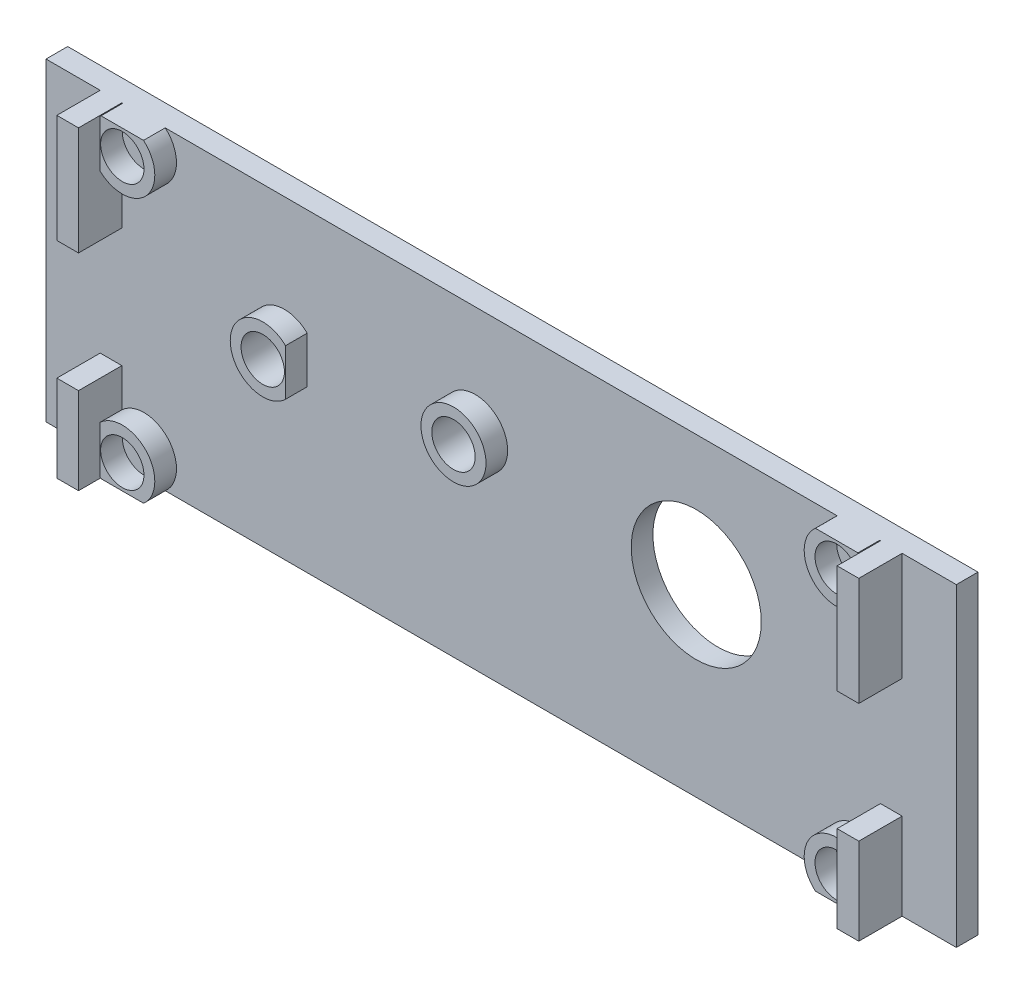
from build123d import *

# Parameters (mm, degrees)
SCHIZZO2_W                   = 42
SCHIZZO2_H                   = 14.5
SCHIZZO2_R                   = 3
SCHIZZO2_R_2                 = 1
ESTRUSIONE_ESTRUSIONE1_DEPTH = 1
SCHIZZO4_W                   = 1
SCHIZZO4_H                   = 5
SCHIZZO4_H_2                 = 4
ESTRUSIONE_ESTRUSIONE2_DEPTH = 2
SCHIZZO5_R                   = 1.5
SCHIZZO5_R_2                 = 1
ESTRUSIONE_ESTRUSIONE3_DEPTH = 1
TAGLIO_ESTRUSIONE1_START     = -1
TAGLIO_ESTRUSIONE1_DEPTH     = 1
ESTRUSIONE_ESTRUSIONE4_START = 1
SCHIZZO7_R                   = 1.5
ESTRUSIONE_ESTRUSIONE4_DEPTH = 1


with BuildPart() as part:
    # Schizzo2 → Estrusione-Estrusione1 (new body)
    with BuildSketch(Plane.XY):
        Rectangle(SCHIZZO2_W, SCHIZZO2_H)
        with Locations((9, 1.25)):
            Circle(SCHIZZO2_R, mode=Mode.SUBTRACT)
        with Locations((-1.2, 2.25)):
            Circle(SCHIZZO2_R_2, mode=Mode.SUBTRACT)
        with Locations((-10, 1.25)):
            Circle(SCHIZZO2_R_2, mode=Mode.SUBTRACT)
    extrude(amount=ESTRUSIONE_ESTRUSIONE1_DEPTH)

    # Schizzo4 → Estrusione-Estrusione2 (add)
    with BuildSketch(Plane.XY.offset(1)):
        with Locations((18, 4.75)):
            Rectangle(SCHIZZO4_W, SCHIZZO4_H)
        with Locations((18, -5.25)):
            Rectangle(SCHIZZO4_W, SCHIZZO4_H_2)
        with Locations((-18, -5.25)):
            Rectangle(SCHIZZO4_W, SCHIZZO4_H_2)
        with Locations((-18, 4.75)):
            Rectangle(SCHIZZO4_W, SCHIZZO4_H)
    extrude(amount=ESTRUSIONE_ESTRUSIONE2_DEPTH)

    # Schizzo5 → Estrusione-Estrusione3 (add)
    # profile 1 of 6: a face of its own
    with BuildSketch(Plane.XY.offset(1)):
        with Locations(Location((-1.2, 2.25, 0), (0, 0, 180))):
            Circle(SCHIZZO5_R)
        with Locations((-1.2, 2.25)):
            Circle(SCHIZZO5_R_2, mode=Mode.SUBTRACT)
    # profile 2 of 6: a face of its own
    with BuildSketch(Plane.XY.offset(1)):
        with Locations(Location((-10, 1.25, 0), (0, 0, 180))):
            Circle(SCHIZZO5_R)
        with Locations((-10, 1.25)):
            Circle(SCHIZZO5_R_2, mode=Mode.SUBTRACT)
    # profile 3 of 6: a face of its own
    with BuildSketch(Plane.XY.offset(1)):
        with BuildLine():
            Line((-17.5, 7.214212601), (-17.5, 5.014576268))
            ThreePointArc((-17.5, 5.014576268), (-15.362109211, 5.114234355), (-15.5, 7.25))
            Line((-15.5, 7.25), (-17.46, 7.25))
            ThreePointArc((-17.46, 7.25), (-17.480160079, 7.232285223), (-17.5, 7.214212601))
        make_face()
        with Locations((-16.48, 6.114394435)):
            Circle(SCHIZZO5_R_2, mode=Mode.SUBTRACT)
    # profile 4 of 6: a face of its own
    with BuildSketch(Plane.XY.offset(1)):
        with BuildLine():
            Line((-17.46, -7.25), (-15.5, -7.25))
            ThreePointArc((-15.5, -7.25), (-15.362109211, -5.114234355), (-17.5, -5.014576268))
            Line((-17.5, -5.014576268), (-17.5, -7.214212601))
            ThreePointArc((-17.5, -7.214212601), (-17.480160079, -7.232285223), (-17.46, -7.25))
        make_face()
        with Locations(Location((-16.48, -6.114394435, 0), (0, 0, 180))):
            Circle(SCHIZZO5_R_2, mode=Mode.SUBTRACT)
    # profile 5 of 6: a face of its own
    with BuildSketch(Plane.XY.offset(1)):
        with BuildLine():
            Line((17.46, -7.25), (15.5, -7.25))
            ThreePointArc((15.5, -7.25), (15.362109211, -5.114234355), (17.5, -5.014576268))
            Line((17.5, -5.014576268), (17.5, -7.214212601))
            ThreePointArc((17.5, -7.214212601), (17.480160079, -7.232285223), (17.46, -7.25))
        make_face()
        with Locations((16.48, -6.114394435)):
            Circle(SCHIZZO5_R_2, mode=Mode.SUBTRACT)
    # profile 6 of 6: a face of its own
    with BuildSketch(Plane.XY.offset(1)):
        with BuildLine():
            Line((17.46, 7.25), (15.5, 7.25))
            ThreePointArc((15.5, 7.25), (15.362109211, 5.114234355), (17.5, 5.014576268))
            Line((17.5, 5.014576268), (17.5, 7.214212601))
            ThreePointArc((17.5, 7.214212601), (17.480160079, 7.232285223), (17.46, 7.25))
        make_face()
        with Locations(Location((16.48, 6.114394435, 0), (0, 0, 180))):
            Circle(SCHIZZO5_R_2, mode=Mode.SUBTRACT)
    extrude(amount=ESTRUSIONE_ESTRUSIONE3_DEPTH)

    # Schizzo6 → Taglio-Estrusione1 (cut)
    with BuildSketch(Plane.XY.offset(2).offset(TAGLIO_ESTRUSIONE1_START)):
        with BuildLine():
            Line((-8.949725473, 2.320945105), (-8.949725473, 0.179054895))
            ThreePointArc((-8.949725473, 0.179054895), (-8.5, 1.25), (-8.949725473, 2.320945105))
        make_face()
    extrude(amount=TAGLIO_ESTRUSIONE1_DEPTH, mode=Mode.SUBTRACT)

    # Schizzo7 → Estrusione-Estrusione4 (add)
    with BuildSketch(Plane(origin=(0, 0, 0), x_dir=(-1, 0, 0), z_dir=(0, 0, -1)).offset(ESTRUSIONE_ESTRUSIONE4_START)):
        with Locations((10, 1.25)):
            Circle(SCHIZZO7_R)
        with BuildLine():
            Line((1.2, 3.75), (1.2, 0.75))
            ThreePointArc((1.2, 0.75), (2.7, 2.25), (1.2, 3.75))
        make_face()
    extrude(amount=-ESTRUSIONE_ESTRUSIONE4_DEPTH)


solid = part.part
